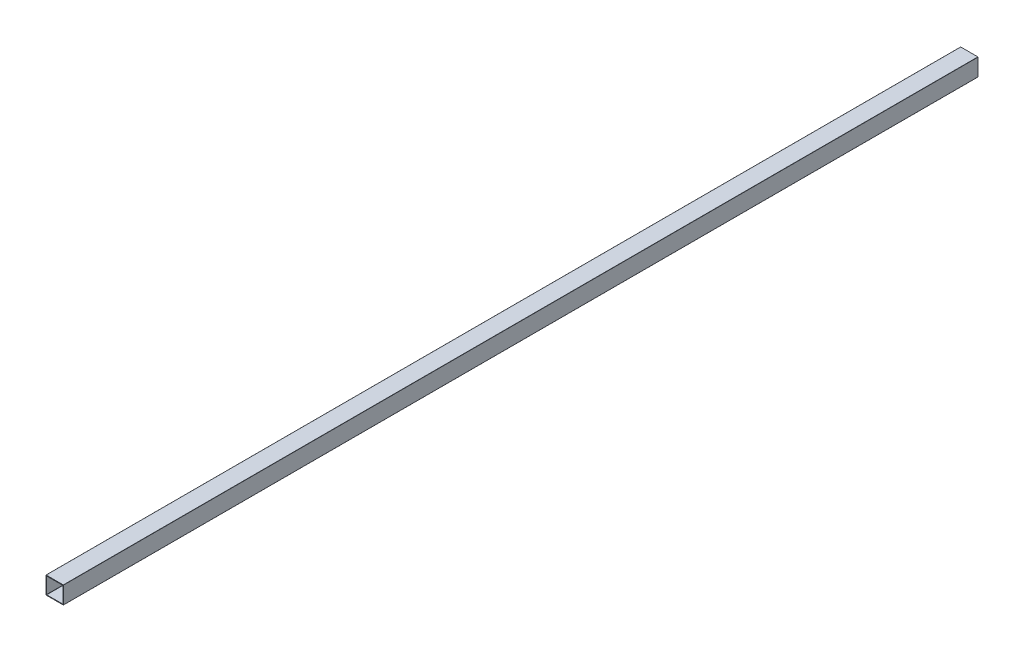
from build123d import *

# Parameters (mm, degrees)
CROQUIS1_W              = 114.3
CROQUIS1_H              = 114.3
CROQUIS1_W_2            = 106.7
CROQUIS1_H_2            = 106.7
SALIENTE_EXTRUIR1_DEPTH = 6000
REDONDEO1_R             = 1


with BuildPart() as part:
    # Croquis1 → Saliente-Extruir1 (new body)
    with BuildSketch(Plane.XY):
        Rectangle(CROQUIS1_W, CROQUIS1_H)
        Rectangle(CROQUIS1_W_2, CROQUIS1_H_2, mode=Mode.SUBTRACT)
    extrude(amount=-SALIENTE_EXTRUIR1_DEPTH)

    # Redondeo1
    redondeo1_edges = [part.edges().sort_by_distance(p)[0] for p in [
        (53.35, -53.35, -3000),
        (-53.35, -53.35, -3000),
        (-53.35, 53.35, -3000),
        (53.35, 53.35, -3000),
        (57.15, -57.15, -3000),
        (-57.15, -57.15, -3000),
        (-57.15, 57.15, -3000),
        (57.15, 57.15, -3000),
    ]]
    fillet(redondeo1_edges, radius=REDONDEO1_R)


solid = part.part
